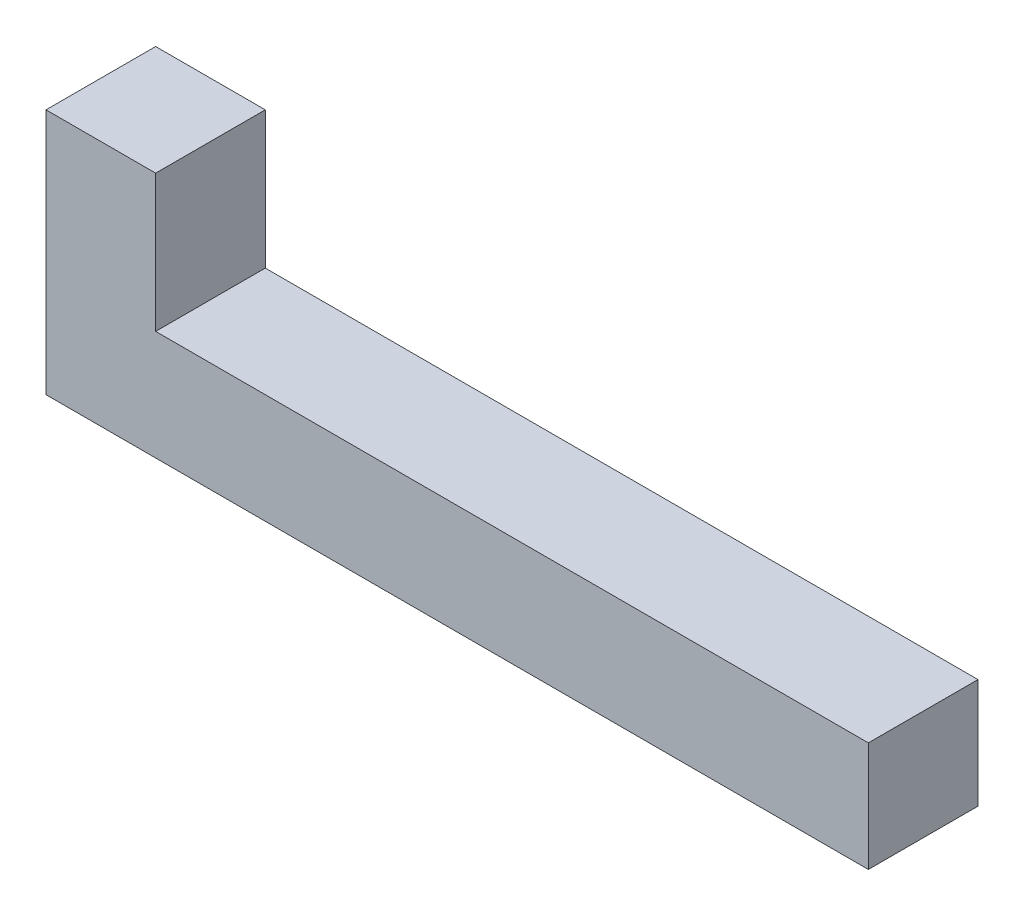
from build123d import *

# Parameters (mm, degrees)
BOSS_EXTRUDE1_DEPTH = 200


with BuildPart() as part:
    # Sketch1 → Boss-Extrude1 (new body)
    with BuildSketch(Plane.XY):
        Polygon((0, 0), (200, 0), (200, -250), (1500, -250), (1500, -450), (264.062231021, -450), (0, -450), align=None)
    extrude(amount=BOSS_EXTRUDE1_DEPTH)


solid = part.part
